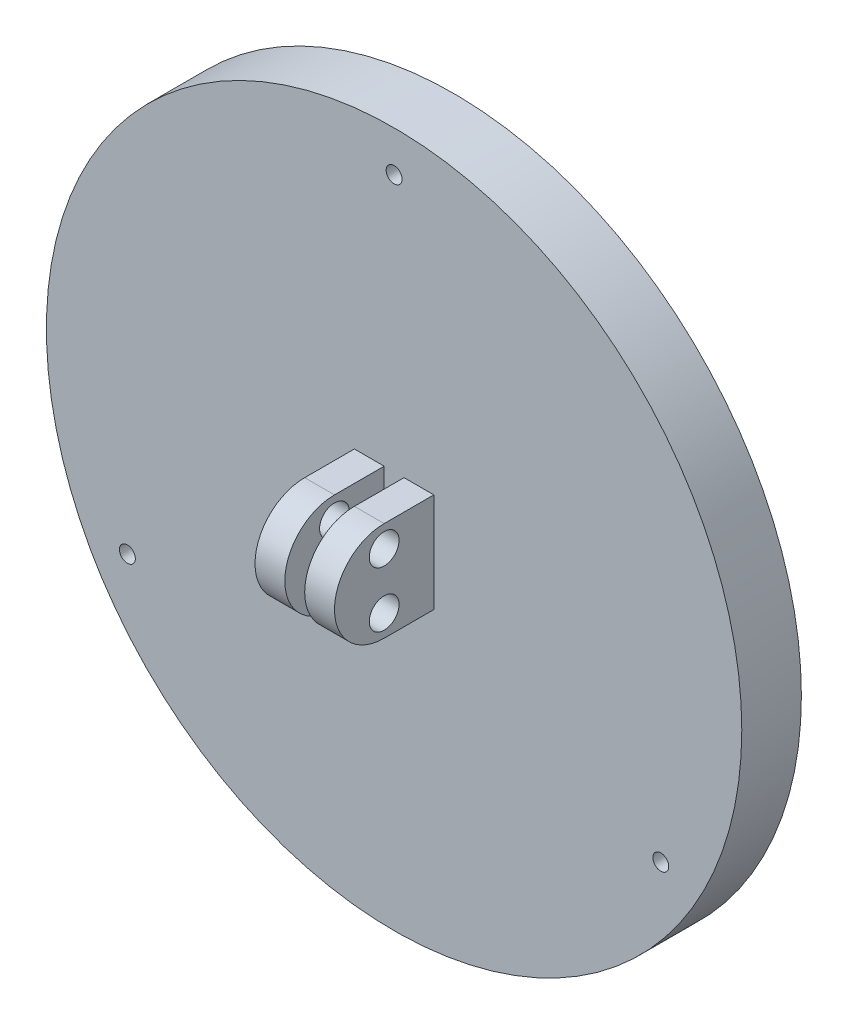
from build123d import *

# Parameters (mm, degrees)
SKETCH2_R           = 35
BOSS_EXTRUDE1_DEPTH = 6
SKETCH3_R           = 0.8
CUT_EXTRUDE1_DEPTH  = 6
SKETCH4_R           = 0.6
CUT_EXTRUDE2_DEPTH  = 6
SKETCH5_W           = 3
SKETCH5_H           = 10
BOSS_EXTRUDE2_DEPTH = 10
CUT_EXTRUDE3_DEPTH  = 55.790510127
SKETCH7_R           = 1.5
CUT_EXTRUDE4_DEPTH  = 55.790510127


with BuildPart() as part:
    # Sketch2 → Boss-Extrude1 (new body)
    with BuildSketch(Plane.XY):
        Circle(SKETCH2_R)
    extrude(amount=BOSS_EXTRUDE1_DEPTH)

    # Sketch3 → Cut-Extrude1 (cut)
    with BuildSketch(Plane.XY.offset(6)):
        with Locations((0, 30.914278185)):
            Circle(SKETCH3_R)
        with Locations((26.846787517, -15.585721815)):
            Circle(SKETCH3_R)
        with Locations((-26.846787517, -15.585721815)):
            Circle(SKETCH3_R)
    extrude(amount=-CUT_EXTRUDE1_DEPTH, mode=Mode.SUBTRACT)

    # Sketch4 → Cut-Extrude2 (cut)
    with BuildSketch(Plane.XY.offset(6)):
        Circle(SKETCH4_R)
    extrude(amount=-CUT_EXTRUDE2_DEPTH, mode=Mode.SUBTRACT)

    # Sketch5 → Boss-Extrude2 (add)
    with BuildSketch(Plane.XY.offset(6)):
        with Locations((2.5, 0)):
            Rectangle(SKETCH5_W, SKETCH5_H)
        with Locations((-2.5, 0)):
            Rectangle(SKETCH5_W, SKETCH5_H)
    extrude(amount=BOSS_EXTRUDE2_DEPTH)

    # Sketch6 → Cut-Extrude3 (cut, through all)
    with BuildSketch(Plane(origin=(4, 0, 0), x_dir=(0, 0, -1), z_dir=(1, 0, 0))):
        with BuildLine():
            ThreePointArc((-16, 0), (-14.535533906, 3.535533906), (-11, 5))
            Line((-11, 5), (-16, 5))
            Line((-16, 5), (-16, 0))
        make_face()
        with BuildLine():
            ThreePointArc((-11, -5), (-14.535533906, -3.535533906), (-16, 0))
            Line((-16, 0), (-16, -5))
            Line((-16, -5), (-11, -5))
        make_face()
    extrude(amount=-CUT_EXTRUDE3_DEPTH, mode=Mode.SUBTRACT)

    # Sketch7 → Cut-Extrude4 (cut, through all)
    with BuildSketch(Plane(origin=(4, 0, 0), x_dir=(0, 0, -1), z_dir=(1, 0, 0))):
        with Locations(Location((-11, 2.8, 0), (0, 0, 90))):
            Circle(SKETCH7_R)
        with Locations(Location((-11, -2.8, 0), (0, 0, 90))):
            Circle(SKETCH7_R)
    extrude(amount=-CUT_EXTRUDE4_DEPTH, mode=Mode.SUBTRACT)


solid = part.part
